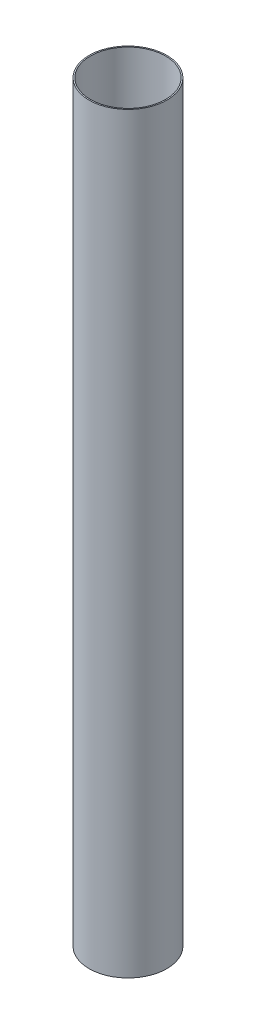
from build123d import *

# Parameters (mm, degrees)
SKETCH1_R           = 39.37
SKETCH1_R_2         = 38.1
BOSS_EXTRUDE2_DEPTH = 762


with BuildPart() as part:
    # Sketch1 → Boss-Extrude2 (new body)
    with BuildSketch(Plane(origin=(0, 0, 0), x_dir=(1, 0, 0), z_dir=(0, 1, 0))):
        with Locations(Location((0, 0, 0), (0, 0, 270))):
            Circle(SKETCH1_R)
        with Locations(Location((0, 0, 0), (0, 0, 270))):
            Circle(SKETCH1_R_2, mode=Mode.SUBTRACT)
    extrude(amount=BOSS_EXTRUDE2_DEPTH)


solid = part.part
